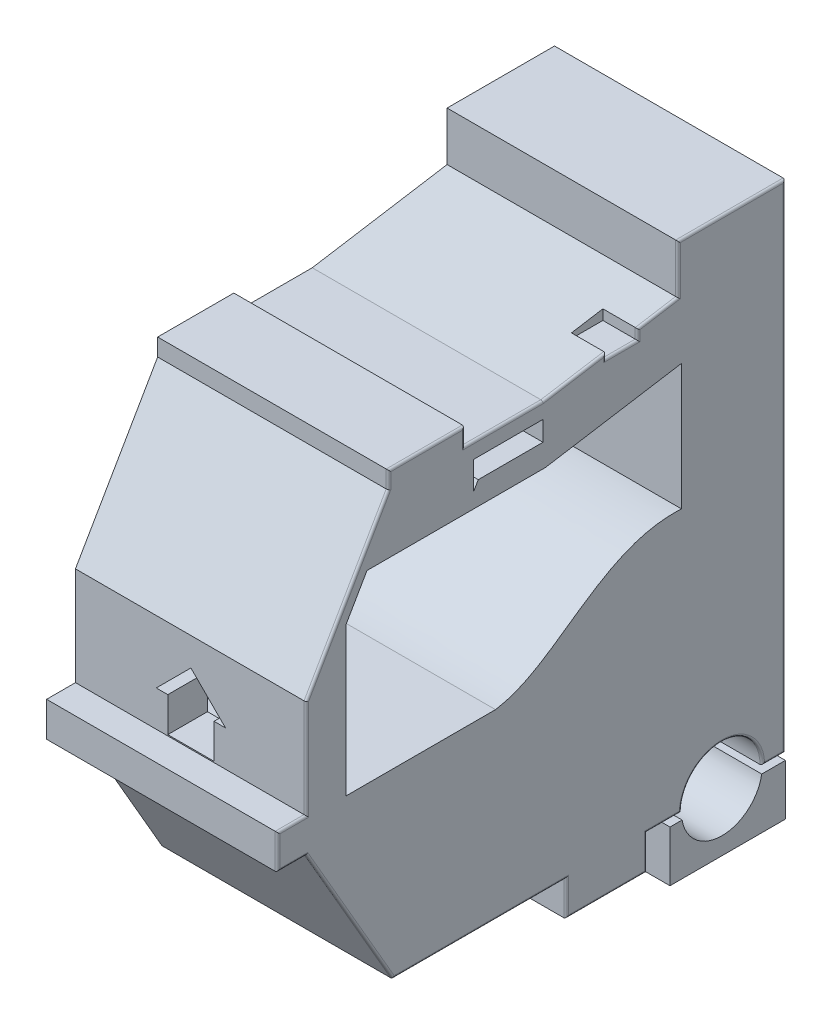
from build123d import *

# Parameters (mm, degrees)
BOSS_EXTRUDE4_DEPTH   = 20
BOSS_EXTRUDE4_2_DEPTH = 20
SKETCH2_W             = 2.726749215
SKETCH2_H             = 1.108217781
CUT_EXTRUDE1_DEPTH    = 3
CUT_EXTRUDE2_DEPTH    = 3.438454738
FILLET3_R             = 0.2
SKETCH5_W             = 15.257743359
SKETCH5_H             = 3.852751868
BOSS_EXTRUDE6_DEPTH   = 0.5


with BuildPart() as part:
    # Sketch1 → Boss-Extrude4 (new body)
    with BuildSketch(Plane(origin=(0, 0, 0), x_dir=(0, 0, -1), z_dir=(1, 0, 0))):
        with BuildLine():
            Line((3.5, 0), (5.5, 0))
            Line((5.5, 0), (5.5, 43))
            Line((5.5, 43), (-3.806743928, 43))
            Line((-3.806743928, 43), (-3.806743928, 38.760188506))
            Line((-3.806743928, 38.760188506), (-15.486850398, 36.858128752))
            Line((-15.486850398, 36.858128752), (-22.281500583, 36.858128752))
            Line((-22.281500583, 36.858128752), (-22.281500583, 38.358128752))
            Line((-22.281500583, 38.358128752), (-28.880599398, 38.358128752))
            Line((-28.880599398, 38.358128752), (-28.880599398, 36.858128752))
            Line((-28.880599398, 36.858128752), (-36, 24.526965191))
            Line((-36, 24.526965191), (-36, 15.990381057))
            Line((-36, 15.990381057), (-38.5, 15.990381057))
            Line((-38.5, 15.990381057), (-38.5, 12.990381057))
            Line((-38.5, 12.990381057), (-36, 12.990381057))
            Line((-36, 12.990381057), (-28.5, 0))
            Line((-28.5, 0), (-13.5, 0))
            Line((-13.5, 0), (-13.5, -3))
            Line((-13.5, -3), (-6.5, -3))
            Line((-6.5, -3), (-6.5, 0))
            Line((-6.5, 0), (-3.5, 0))
            ThreePointArc((-3.5, 0), (0, 3.5), (3.5, 0))
        make_face()
        Polygon((-21.513655911, 33.751666658), (-21.513655911, 33.071841875), (-21.109510722, 33.771841875), (-15.5, 33.771841875), (-15.5, 35.490029279), (-21.513655911, 35.490029279), align=None, mode=Mode.SUBTRACT)
        with BuildLine():
            Line((-32.561545262, 15.771841875), (-32.561545262, 28.629664887))
            Line((-32.561545262, 28.629664887), (-30.747408532, 31.771841875))
            Line((-30.747408532, 31.771841875), (-15.295375391, 31.771841875))
            Line((-15.295375391, 31.771841875), (-3.5, 33.692672724))
            Line((-3.5, 33.692672724), (-3.5, 22.771841875))
            add(Edge.make_bspline(
                [(-19.613060355, 15.771841875), (-17.641693556, 16.075420699), (-12.572544243, 19.227163792), (-7.991758563, 23.043956777), (-3.5, 22.771841875)],
                knots=[0, 0, 0, 0, 0.328341764, 1, 1, 1, 1], degree=3))
            Line((-19.613060355, 15.771841875), (-32.561545262, 15.771841875))
        make_face(mode=Mode.SUBTRACT)
    extrude(amount=BOSS_EXTRUDE4_DEPTH)

    # Sketch2 → Cut-Extrude1 (cut)
    with BuildSketch(Plane(origin=(20, 0, 0), x_dir=(0, 0, -1), z_dir=(1, 0, 0))):
        with Locations((-8.673305173, 37.869668981)):
            Rectangle(SKETCH2_W, SKETCH2_H)
    extrude(amount=-CUT_EXTRUDE1_DEPTH, mode=Mode.SUBTRACT)

    # Sketch3 → Cut-Extrude2 (cut)
    with BuildSketch(Plane.XY.offset(36)):
        Polygon((8, 16.090381057), (12, 16.090381057), (12, 19.090381057), (13, 19.090381057), (10, 22.090381057), (7, 19.090381057), (8, 19.090381057), align=None)
    extrude(amount=-CUT_EXTRUDE2_DEPTH, mode=Mode.SUBTRACT)

    # Fillet3
    fillet3_edges = [part.edges().sort_by_distance(p)[0] for p in [
        (20, 21.5, -5.5),
        (20, 37.752634163, 7.309930565),
        (20, 37.530613929, 10.03667978),
        (20, 37.315560091, 8.673305173),
        (20, 43, -0.846628036),
        (20, 40.880094253, 3.806743928),
        (20, 38.47494837, 5.558337246),
        (20, 36.858128752, 18.88417549),
        (20, 37.608128752, 22.281500583),
        (20, 38.358128752, 25.581049991),
        (20, 37.608128752, 28.880599398),
        (20, 30.692546971, 32.440299699),
        (20, 20.258673124, 36),
        (20, 3.5, 0),
        (20, 15.990381057, 37.25),
        (20, 14.490381057, 38.5),
        (20, 12.990381057, 37.25),
        (20, 6.495190528, 32.25),
        (20, 0, 21),
        (20, -1.5, 13.5),
        (20, -3, 10),
        (20, -1.5, 6.5),
        (20, 0, 5),
        (20, 0, -4.5),
        (20, 37.301898259, 12.761765089),
    ]]
    fillet(fillet3_edges, radius=FILLET3_R)

    # Sketch5 → Boss-Extrude6 (add)
    with BuildSketch(Plane.ZY):
        with Locations((9.857947025, 11.094561214)):
            Rectangle(SKETCH5_W, SKETCH5_H)
    extrude(amount=BOSS_EXTRUDE6_DEPTH)


with BuildPart() as body_2:
    # Sketch1 → Boss-Extrude4 2 (new body)
    with BuildSketch(Plane(origin=(0, 0, 0), x_dir=(0, 0, -1), z_dir=(1, 0, 0))):
        with BuildLine():
            Line((-3.449625002, -0.591681791), (-4.5, -0.591681791))
            Line((-4.5, -0.591681791), (-4.5, -5))
            Line((-4.5, -5), (5.5, -5))
            Line((5.5, -5), (5.5, -0.591681791))
            Line((5.5, -0.591681791), (3.449625002, -0.591681791))
            ThreePointArc((3.449625002, -0.591681791), (0, -3.5), (-3.449625002, -0.591681791))
        make_face()
    extrude(amount=BOSS_EXTRUDE4_2_DEPTH)


solid = Compound([part.part, body_2.part])
